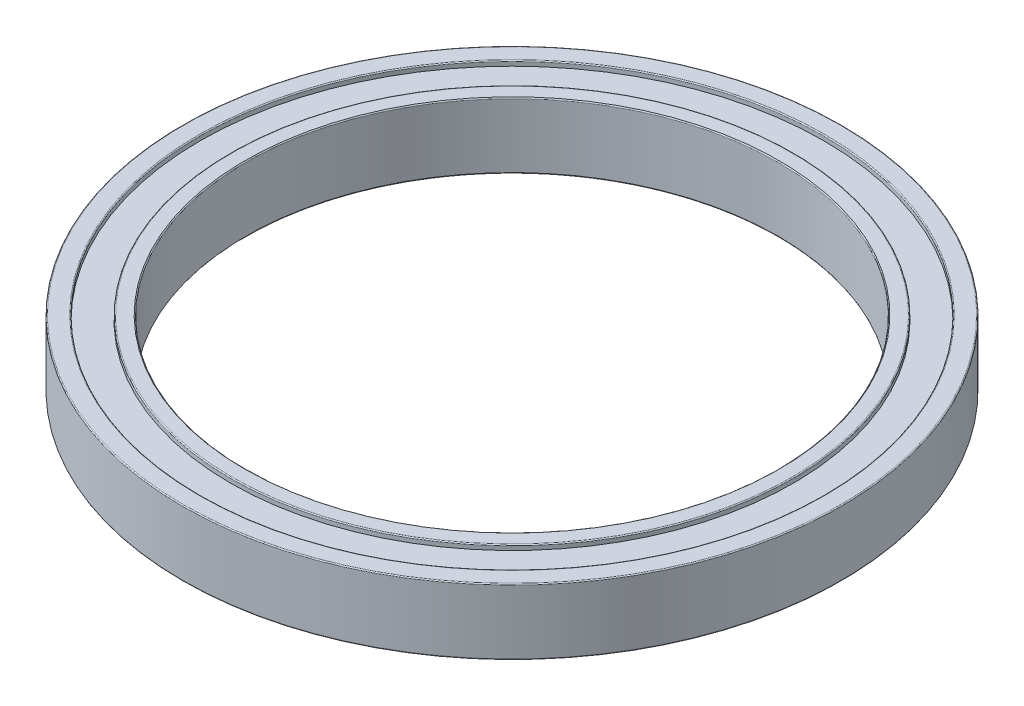
from build123d import *

# Parameters (mm, degrees)
SKETCH_1_R          = 65
SKETCH_1_R_2        = 52.5
EXTRUDE_1_DEPTH     = 13
SKETCH_2_R          = 61.5
SKETCH_2_R_2        = 55.5
CUT_EXTRUDE_1_DEPTH = 1
FILLET_1_R          = 0.2
FILLET_2_R          = 0.2


with BuildPart() as part:
    # 草图1 → 凸台-拉伸1 (new body)
    with BuildSketch(Plane(origin=(0, 0, 0), x_dir=(1, 0, 0), z_dir=(0, 1, 0))):
        with Locations(Location((0, 0, 0), (0, 0, 90))):
            Circle(SKETCH_1_R)
        with Locations(Location((0, 0, 0), (0, 0, 90))):
            Circle(SKETCH_1_R_2, mode=Mode.SUBTRACT)
    extrude(amount=EXTRUDE_1_DEPTH)

    # 草图2 → 切除-拉伸1 (cut)
    with BuildSketch(Plane(origin=(0, 13, 0), x_dir=(1, 0, 0), z_dir=(0, 1, 0))):
        with Locations(Location((0, 0, 0), (0, 0, 270))):
            Circle(SKETCH_2_R)
        with Locations(Location((0, 0, 0), (0, 0, 270))):
            Circle(SKETCH_2_R_2, mode=Mode.SUBTRACT)
    cut_extrude_1 = extrude(amount=-CUT_EXTRUDE_1_DEPTH, mode=Mode.SUBTRACT)

    # 圆角1
    fillet_1_edges = [part.edges().sort_by_distance(p)[0] for p in [
        (0, 13, -61.5),
        (0, 13, -55.5),
        (0, 13, 65),
        (0, 13, 52.5),
    ]]
    fillet(fillet_1_edges, radius=FILLET_1_R)

    # 镜向3: 切除-拉伸1 across plane
    add(cut_extrude_1.mirror(Plane(origin=(0, 6.5, 0), x_dir=(0, 0, 1), z_dir=(0, -1, 0))), mode=Mode.SUBTRACT)

    # 圆角2
    fillet_2_edges = [part.edges().sort_by_distance(p)[0] for p in [
        (0, 0, 65),
        (0, 0, -55.5),
        (0, 0, -61.5),
        (0, 0, 52.5),
    ]]
    fillet(fillet_2_edges, radius=FILLET_2_R)


solid = part.part
